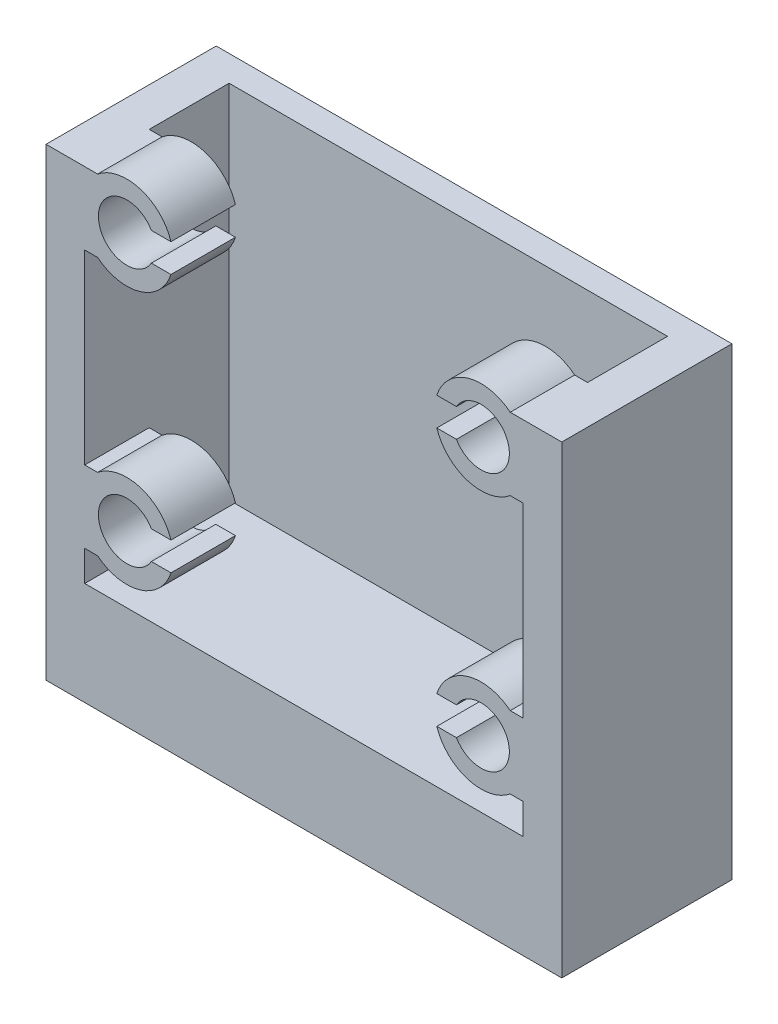
from build123d import *

# Parameters (mm, degrees)
RESSALTO_EXTRUS_O2_DEPTH   = 12.5
RESSALTO_EXTRUS_O2_2_DEPTH = 12.5
ESBO_O2_W                  = 7.5
ESBO_O2_H                  = 64.1
RESSALTO_EXTRUS_O3_DEPTH   = 28
ESBO_O3_W                  = 50
ESBO_O3_H                  = 90
RESSALTO_EXTRUS_O4_DEPTH   = 5
RESSALTO_EXTRUS_O5_DEPTH   = 28


with BuildPart() as part:
    # Esboço1 → Ressalto-extrusão2 (new body)
    with BuildSketch(Plane.XY):
        with BuildLine():
            Line((-4.763139721, 2.75), (-8.569568251, 2.75))
            ThreePointArc((-8.569568251, 2.75), (-2.576160071, 8.623421553), (5.656854249, 7))
            Line((5.656854249, 7), (15.656854249, 7))
            Line((15.656854249, 7), (15.656854249, -7))
            Line((15.656854249, -7), (5.656854249, -7))
            ThreePointArc((5.656854249, -7), (-2.576160071, -8.623421553), (-8.569568251, -2.75))
            Line((-8.569568251, -2.75), (-4.763139721, -2.75))
            ThreePointArc((-4.763139721, -2.75), (5.5, 0), (-4.763139721, 2.75))
        make_face()
    ressalto_extrus_o2 = extrude(amount=RESSALTO_EXTRUS_O2_DEPTH)



with BuildPart() as body_2:
    # Esboço1 → Ressalto-extrus_o2 2 (new body)
    with BuildSketch(Plane.XY):
        with BuildLine():
            Line((15.656854249, -57.1), (15.656854249, -43.1))
            Line((15.656854249, -43.1), (5.656854249, -43.1))
            ThreePointArc((5.656854249, -43.1), (-2.576160071, -41.476578447), (-8.569568251, -47.35))
            Line((-8.569568251, -47.35), (-4.763139721, -47.35))
            ThreePointArc((-4.763139721, -47.35), (5.5, -50.1), (-4.763139721, -52.85))
            Line((-4.763139721, -52.85), (-8.569568251, -52.85))
            ThreePointArc((-8.569568251, -52.85), (-2.576160071, -58.723421553), (5.656854249, -57.1))
            Line((5.656854249, -57.1), (15.656854249, -57.1))
        make_face()
    ressalto_extrus_o2_2 = extrude(amount=RESSALTO_EXTRUS_O2_2_DEPTH)


with BuildPart() as part_1:
    add(part.part)

    add(body_2.part)  # Ressalto-extrusão3 merges body 2
    # Esboço2 → Ressalto-extrusão3 (add)
    with BuildSketch(Plane(origin=(0, 0, 12.5), x_dir=(-1, 0, 0), z_dir=(0, 0, -1))):
        with Locations((-11.906854249, -25.05)):
            Rectangle(ESBO_O2_W, ESBO_O2_H)
    ressalto_extrus_o3 = extrude(amount=RESSALTO_EXTRUS_O3_DEPTH)

    # Esboço3 → Ressalto-extrusão4 (add)
    with BuildSketch(Plane(origin=(0, 0, -15.5), x_dir=(-1, 0, 0), z_dir=(0, 0, -1))):
        with Locations((9.343145751, -38)):
            Rectangle(ESBO_O3_W, ESBO_O3_H)
    ressalto_extrus_o4 = extrude(amount=RESSALTO_EXTRUS_O4_DEPTH)

    # Esboço4 → Ressalto-extrusão5 (add)
    with BuildSketch(Plane.XY.offset(-15.5)):
        Polygon((15.656854249, -83), (-34.343145751, -83), (-34.343145751, -63), (8.156854249, -63), (8.156854249, -57.1), (15.656854249, -57.1), (15.656854249, -63), align=None)
    ressalto_extrus_o5 = extrude(amount=RESSALTO_EXTRUS_O5_DEPTH)

    # Espelhar4: Ressalto-extrusão4, Ressalto-extrusão5 across plane
    add(ressalto_extrus_o4.mirror(Plane(origin=(-34.343145751, 0, 0), x_dir=(0, 0, 1), z_dir=(1, 0, 0))))
    add(ressalto_extrus_o5.mirror(Plane(origin=(-34.343145751, 0, 0), x_dir=(0, 0, 1), z_dir=(1, 0, 0))))

    # Espelhar5: Ressalto-extrusão3 across plane
    add(ressalto_extrus_o3.mirror(Plane(origin=(-34.343145751, 0, 0), x_dir=(0, 0, 1), z_dir=(1, 0, 0))))

    # Espelhar6: Ressalto-extrusão2, Ressalto-extrus_o2 2 across plane
    add(ressalto_extrus_o2.mirror(Plane(origin=(-34.343145751, 0, 0), x_dir=(0, 0, 1), z_dir=(1, 0, 0))))
    add(ressalto_extrus_o2_2.mirror(Plane(origin=(-34.343145751, 0, 0), x_dir=(0, 0, 1), z_dir=(1, 0, 0))))


solid = part_1.part
